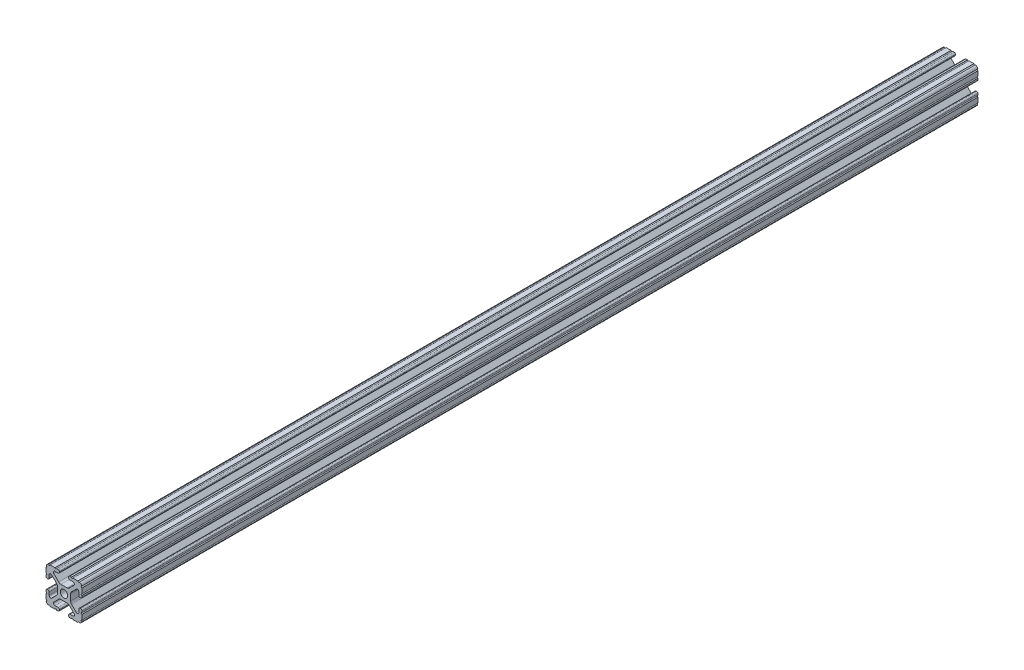
from build123d import *

# Parameters (mm, degrees)
BOSS_EXTRUDE1_DEPTH     = 316.5
CUT_EXTRUDE1_DEPTH      = 318.00919545
CUT_EXTRUDE1_DEPTH_BACK = 318.00919545
SKETCH5_R               = 0.55245


with BuildPart() as part:
    # Sketch4 → Boss-Extrude1 (new, symmetric)
    with BuildSketch(Plane.XY):
        with BuildLine():
            Line((4.190365, -12.7), (10.11729625, -12.7))
            ThreePointArc((10.11729625, -12.7), (11.943543585, -11.943543585), (12.7, -10.11729625))
            Line((12.7, -10.11729625), (12.7, -4.190365))
            ThreePointArc((12.7, -4.190365), (12.42492494, -3.52627506), (11.760835, -3.2512))
            Line((11.760835, -3.2512), (11.429365, -3.2512))
            ThreePointArc((11.429365, -3.2512), (10.76527506, -3.52627506), (10.4902, -4.190365))
            Line((10.4902, -4.190365), (10.4902, -6.348478019))
            ThreePointArc((10.4902, -6.348478019), (9.830707141, -7.335478831), (8.666460301, -7.103895736))
            Line((8.666460301, -7.103895736), (5.299899128, -3.737334563))
            ThreePointArc((5.299899128, -3.737334563), (4.817571085, -3.015479634), (4.6482, -2.16399369))
            Line((4.6482, -2.16399369), (4.6482, 0))
            Line((4.6482, 0), (2.6035, 0))
            ThreePointArc((2.6035, 0), (1.840952505, -1.840952505), (0, -2.6035))
            Line((0, -2.6035), (0, -4.6482))
            Line((0, -4.6482), (2.16399369, -4.6482))
            ThreePointArc((2.16399369, -4.6482), (3.015479634, -4.817571085), (3.737334563, -5.299899128))
            Line((3.737334563, -5.299899128), (7.103895736, -8.666460301))
            ThreePointArc((7.103895736, -8.666460301), (7.335478831, -9.830707141), (6.348478019, -10.4902))
            Line((6.348478019, -10.4902), (4.190365, -10.4902))
            ThreePointArc((4.190365, -10.4902), (3.52627506, -10.76527506), (3.2512, -11.429365))
            Line((3.2512, -11.429365), (3.2512, -11.760835))
            ThreePointArc((3.2512, -11.760835), (3.52627506, -12.42492494), (4.190365, -12.7))
        make_face()
    extrude(amount=BOSS_EXTRUDE1_DEPTH, both=True)

    # Sketch5 → Cut-Extrude1 (cut, two sides: drawn at the far end of the back side and taken through both)
    with BuildSketch(Plane.XY.offset(-CUT_EXTRUDE1_DEPTH_BACK)):
        with Locations((10.356153152, -12.7)):
            Circle(SKETCH5_R)
        with Locations((5.796028019, -12.7)):
            Circle(SKETCH5_R)
        with Locations((12.7, -10.356153152)):
            Circle(SKETCH5_R)
        with Locations((12.7, -5.796028019)):
            Circle(SKETCH5_R)
    extrude(amount=CUT_EXTRUDE1_DEPTH + CUT_EXTRUDE1_DEPTH_BACK, mode=Mode.SUBTRACT)

    # Mirror1: part across plane


with BuildPart() as part_1:
    add(part.part)
    add(part.part.mirror(Plane(origin=(0, 0, 0), x_dir=(0, 0, 1), z_dir=(1, 0, 0))))

    # Mirror2: part across plane


with BuildPart() as part_2:
    add(part_1.part)
    add(part_1.part.mirror(Plane.ZX))


solid = part_2.part
